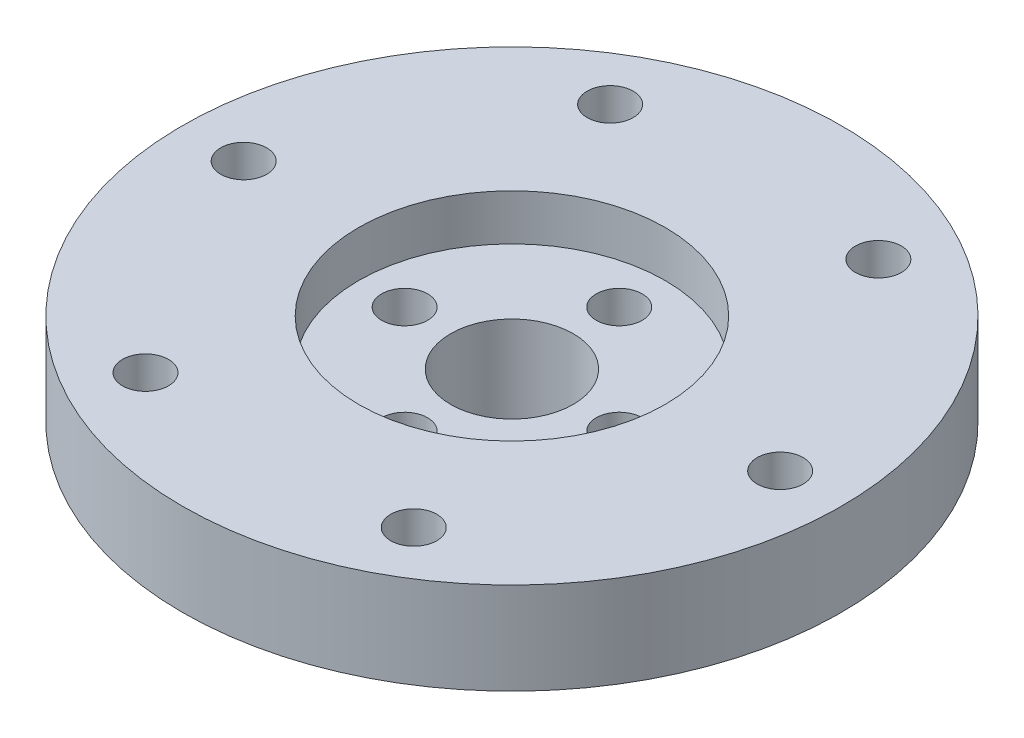
from build123d import *

# Parameters (mm, degrees)
SKETCH_1_R      = 21.5
SKETCH_1_R_2    = 4
SKETCH_1_R_3    = 1.5
EXTRUDE_1_DEPTH = 3
SKETCH_2_R      = 21.5
SKETCH_2_R_2    = 1.5
SKETCH_2_R_3    = 10
EXTRUDE_2_DEPTH = 3
EXTRUDE_START   = 3
SKETCH_3_R      = 14
SKETCH_3_R_2    = 1.5
SKETCH_3_R_3    = 4
EXTRUDE_3_DEPTH = 3


with BuildPart() as part:
    # 草图1 → 凸台-拉伸1 (new body)
    with BuildSketch(Plane(origin=(0, 0, 0), x_dir=(1, 0, 0), z_dir=(0, 1, 0))):
        with Locations(Location((0, 0, 0), (0, 0, 270))):
            Circle(SKETCH_1_R)
        with Locations(Location((0, 0, 0), (0, 0, 270))):
            Circle(SKETCH_1_R_2, mode=Mode.SUBTRACT)
        with Locations(Location((0, 7, 0), (0, 0, 270))):
            Circle(SKETCH_1_R_3, mode=Mode.SUBTRACT)
        with Locations(Location((7, 0, 0), (0, 0, 270))):
            Circle(SKETCH_1_R_3, mode=Mode.SUBTRACT)
        with Locations(Location((0, -7, 0), (0, 0, 90))):
            Circle(SKETCH_1_R_3, mode=Mode.SUBTRACT)
        with Locations(Location((-7, 0, 0), (0, 0, 90))):
            Circle(SKETCH_1_R_3, mode=Mode.SUBTRACT)
        with Locations(Location((8.75, 15.155444566, 0), (0, 0, 270))):
            Circle(SKETCH_1_R_3, mode=Mode.SUBTRACT)
        with Locations(Location((17.5, 0, 0), (0, 0, 270))):
            Circle(SKETCH_1_R_3, mode=Mode.SUBTRACT)
        with Locations(Location((-17.5, 0, 0), (0, 0, 90))):
            Circle(SKETCH_1_R_3, mode=Mode.SUBTRACT)
        with Locations(Location((-8.75, 15.155444566, 0), (0, 0, 90))):
            Circle(SKETCH_1_R_3, mode=Mode.SUBTRACT)
        with Locations(Location((8.75, -15.155444566, 0), (0, 0, 90))):
            Circle(SKETCH_1_R_3, mode=Mode.SUBTRACT)
        with Locations(Location((-8.75, -15.155444566, 0), (0, 0, 270))):
            Circle(SKETCH_1_R_3, mode=Mode.SUBTRACT)
    extrude(amount=EXTRUDE_1_DEPTH)

    # 草图2 → 凸台-拉伸2 (add)
    with BuildSketch(Plane(origin=(0, 3, 0), x_dir=(1, 0, 0), z_dir=(0, 1, 0))):
        with Locations(Location((0, 0, 0), (0, 0, 270))):
            Circle(SKETCH_2_R)
        with Locations(Location((-17.5, 0, 0), (0, 0, 90))):
            Circle(SKETCH_2_R_2, mode=Mode.SUBTRACT)
        with Locations(Location((-8.75, -15.155444566, 0), (0, 0, 270))):
            Circle(SKETCH_2_R_2, mode=Mode.SUBTRACT)
        with Locations(Location((8.75, -15.155444566, 0), (0, 0, 90))):
            Circle(SKETCH_2_R_2, mode=Mode.SUBTRACT)
        with Locations(Location((17.5, 0, 0), (0, 0, 270))):
            Circle(SKETCH_2_R_2, mode=Mode.SUBTRACT)
        with Locations(Location((8.75, 15.155444566, 0), (0, 0, 270))):
            Circle(SKETCH_2_R_2, mode=Mode.SUBTRACT)
        with Locations(Location((-8.75, 15.155444566, 0), (0, 0, 90))):
            Circle(SKETCH_2_R_2, mode=Mode.SUBTRACT)
        with Locations(Location((0, 0, 0), (0, 0, 270))):
            Circle(SKETCH_2_R_3, mode=Mode.SUBTRACT)
    extrude(amount=EXTRUDE_2_DEPTH)

    # 草图3 → 凸台-拉伸3 (add)
    with BuildSketch(Plane.XZ.offset(EXTRUDE_START)):
        with Locations(Location((0, 0, 0), (0, 0, 90))):
            Circle(SKETCH_3_R)
        with Locations(Location((7, 0, 0), (0, 0, 270))):
            Circle(SKETCH_3_R_2, mode=Mode.SUBTRACT)
        with Locations(Location((0, 0, 0), (0, 0, 270))):
            Circle(SKETCH_3_R_3, mode=Mode.SUBTRACT)
        with Locations(Location((0, -7, 0), (0, 0, 270))):
            Circle(SKETCH_3_R_2, mode=Mode.SUBTRACT)
        with Locations(Location((-7, 0, 0), (0, 0, 270))):
            Circle(SKETCH_3_R_2, mode=Mode.SUBTRACT)
        with Locations(Location((0, 7, 0), (0, 0, 270))):
            Circle(SKETCH_3_R_2, mode=Mode.SUBTRACT)
    extrude(amount=-EXTRUDE_3_DEPTH)


solid = part.part
